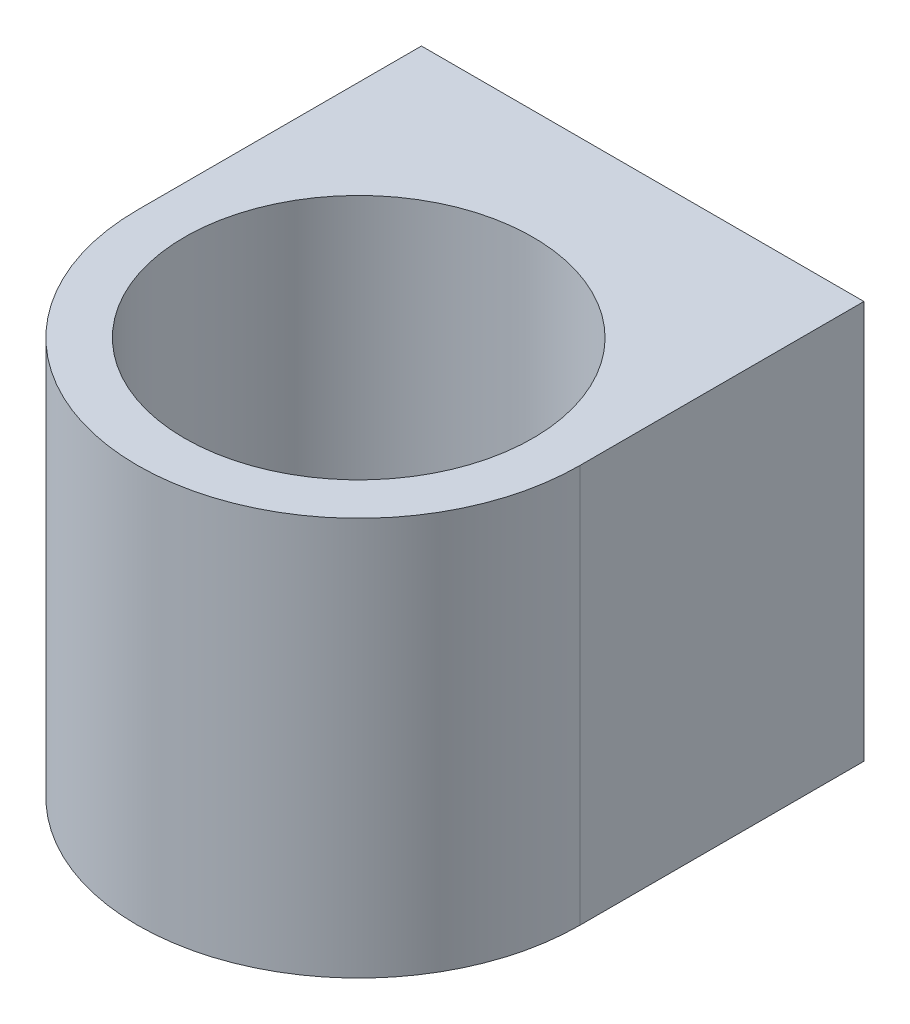
from build123d import *

# Parameters (mm, degrees)
BOSS_EXTRUDE1_DEPTH      = 12.7
BOSS_EXTRUDE1_DEPTH_BACK = 12.7
SKETCH1_R                = 11.1125
SKETCH2_R                = 3
CUT_EXTRUDE1_DEPTH       = 7


with BuildPart() as part:
    # Sketch1 → Boss-Extrude1 (new, two sides: drawn at the far end of the back side and taken through both)
    with BuildSketch(Plane(origin=(0, 0, 0), x_dir=(1, 0, 0), z_dir=(0, 1, 0)).offset(-BOSS_EXTRUDE1_DEPTH_BACK)):
        with BuildLine():
            Line((-14.1125, 0), (-14.1125, 14.1125))
            Line((-14.1125, 14.1125), (-14.1125, 18.1125))
            Line((-14.1125, 18.1125), (14.1125, 18.1125))
            Line((14.1125, 18.1125), (14.1125, 14.1125))
            Line((14.1125, 14.1125), (14.1125, 0))
            ThreePointArc((14.1125, 0), (0, -14.1125), (-14.1125, 0))
        make_face()
        Circle(SKETCH1_R, mode=Mode.SUBTRACT)
    extrude(amount=BOSS_EXTRUDE1_DEPTH + BOSS_EXTRUDE1_DEPTH_BACK)

    # Sketch2 → Cut-Extrude1 (cut)
    with BuildSketch(Plane(origin=(0, 0, -18.1125), x_dir=(-1, 0, 0), z_dir=(0, 0, -1))):
        with Locations((8.1125, -6.7)):
            Circle(SKETCH2_R)
        with Locations((-8.1125, -6.7)):
            Circle(SKETCH2_R)
        with Locations((-8.1125, 6.7)):
            Circle(SKETCH2_R)
        with Locations((8.1125, 6.7)):
            Circle(SKETCH2_R)
    extrude(amount=-CUT_EXTRUDE1_DEPTH, mode=Mode.SUBTRACT)


solid = part.part
